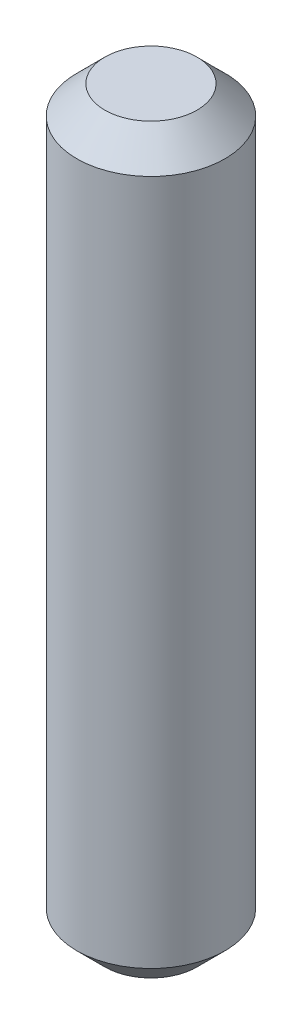
from build123d import *

# Parameters (mm, degrees)
SKETCH1_R           = 1.585
BOSS_EXTRUDE1_DEPTH = 15.87
CHAMFER1_SIZE       = 0.6
CHAMFER2_SIZE       = 0.6


with BuildPart() as part:
    # Sketch1 → Boss-Extrude1 (new body)
    with BuildSketch(Plane(origin=(0, 0, 0), x_dir=(1, 0, 0), z_dir=(0, 1, 0))):
        with Locations(Location((0, 0, 0), (0, 0, 270))):
            Circle(SKETCH1_R)
    extrude(amount=BOSS_EXTRUDE1_DEPTH)

    # Chamfer1
    chamfer1_edges = [part.edges().sort_by_distance(p)[0] for p in [
        (0, 15.87, -1.585),
    ]]
    chamfer(chamfer1_edges, length=CHAMFER1_SIZE)

    # Chamfer2
    chamfer2_edges = [part.edges().sort_by_distance(p)[0] for p in [
        (0, 0, -1.585),
    ]]
    chamfer(chamfer2_edges, length=CHAMFER2_SIZE)


solid = part.part
